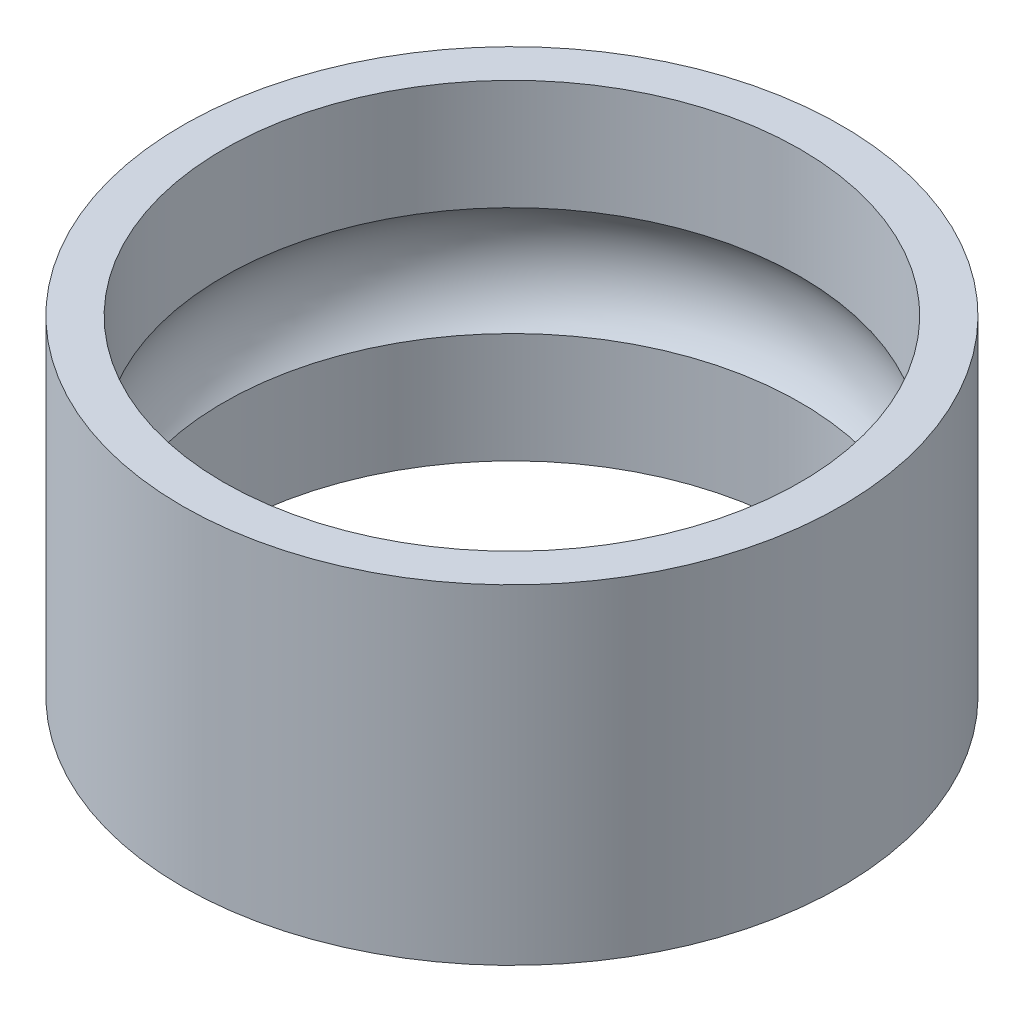
from build123d import *

# Parameters (mm, degrees)
DIAPROFILES_R         = 4
DIAPROFILES_R_2       = 3.5
DIAPROFILE_DEPTH      = 2
BEARINGPATHPROFILES_R = 1


with BuildPart() as part:
    # DiaProfileS → DiaProfile (new, symmetric)
    with BuildSketch(Plane(origin=(0, 0, 0), x_dir=(1, 0, 0), z_dir=(0, 1, 0))):
        with Locations(Location((0, 0, 0), (0, 0, 270))):
            Circle(DIAPROFILES_R)
        with Locations(Location((0, 0, 0), (0, 0, 270))):
            Circle(DIAPROFILES_R_2, mode=Mode.SUBTRACT)
    extrude(amount=DIAPROFILE_DEPTH, both=True)

    # BearingPathProfileS → BearingPathProfile (revolve, cut)
    with BuildSketch(Plane.XY, mode=Mode.PRIVATE) as bearingpathprofile_sk:
        with Locations((2.75, 0)):
            Circle(BEARINGPATHPROFILES_R)
    revolve(bearingpathprofile_sk.sketch.rotate(Axis((0, 2, 0), (0, -1, 0)), 90), axis=Axis((0, 2, 0), (0, -1, 0)), mode=Mode.SUBTRACT)


solid = part.part
